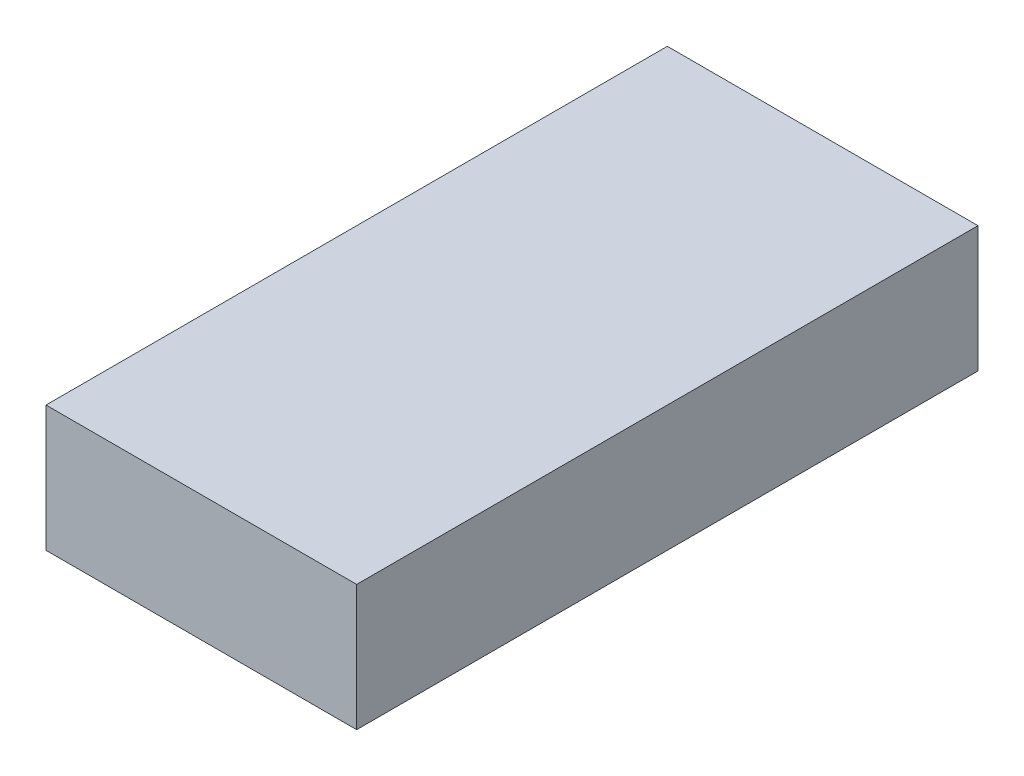
from build123d import *

# Parameters (mm, degrees)
MAINBASESKETCH_W      = 7.9
MAINBASESKETCH_H      = 3.2
MAINBASEEXTRUDE_DEPTH = 7.9
MAINBASESHELL_T       = -1.2


with BuildPart() as part:
    # MainBaseSketch → MainBaseExtrude (new, symmetric)
    with BuildSketch(Plane.XY):
        with Locations((4.631967213, 1.6)):
            Rectangle(MAINBASESKETCH_W, MAINBASESKETCH_H)
    extrude(amount=MAINBASEEXTRUDE_DEPTH, both=True)

    # MainBaseShell
    mainbaseshell_openings = [part.faces().sort_by_distance(p)[0] for p in [
        (4.631967213, 0, 0),
    ]]
    offset(amount=MAINBASESHELL_T, openings=mainbaseshell_openings, kind=Kind.INTERSECTION)


solid = part.part
